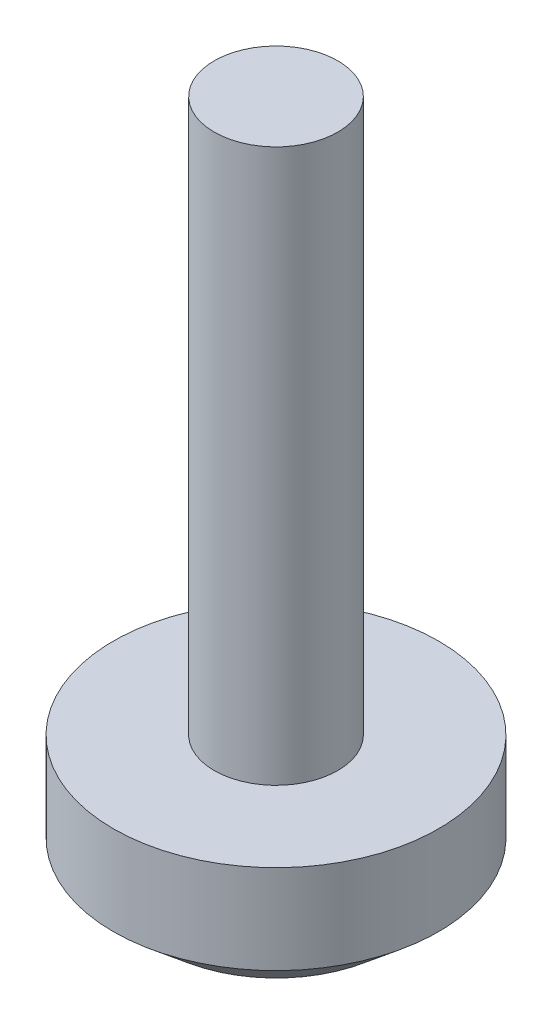
from build123d import *

# Parameters (mm, degrees)
SKETCH1_R           = 5
BOSS_EXTRUDE1_DEPTH = 4
SKETCH2_R           = 1.9
BOSS_EXTRUDE2_DEPTH = 17
CHAMFER1_SIZE       = 1.5
CHAMFER1_SIZE2      = 1.258649447


with BuildPart() as part:
    # Sketch1 → Boss-Extrude1 (new body)
    with BuildSketch(Plane(origin=(0, 0, 0), x_dir=(1, 0, 0), z_dir=(0, 1, 0))):
        with Locations(Location((0, 0, 0), (0, 0, 270))):
            Circle(SKETCH1_R)
    extrude(amount=BOSS_EXTRUDE1_DEPTH)

    # Sketch2 → Boss-Extrude2 (add)
    with BuildSketch(Plane(origin=(0, 4, 0), x_dir=(1, 0, 0), z_dir=(0, 1, 0))):
        with Locations(Location((0, 0, 0), (0, 0, 270))):
            Circle(SKETCH2_R)
    extrude(amount=BOSS_EXTRUDE2_DEPTH)

    # Chamfer1
    chamfer1_edges = [part.edges().sort_by_distance(p)[0] for p in [
        (0, 0, -5),
    ]]
    chamfer1_side = [part.faces().sort_by_distance(p)[0] for p in [
        (0, 0, 0),
    ]]
    chamfer(chamfer1_edges, length=CHAMFER1_SIZE, length2=CHAMFER1_SIZE2, reference=chamfer1_side[0])


solid = part.part
